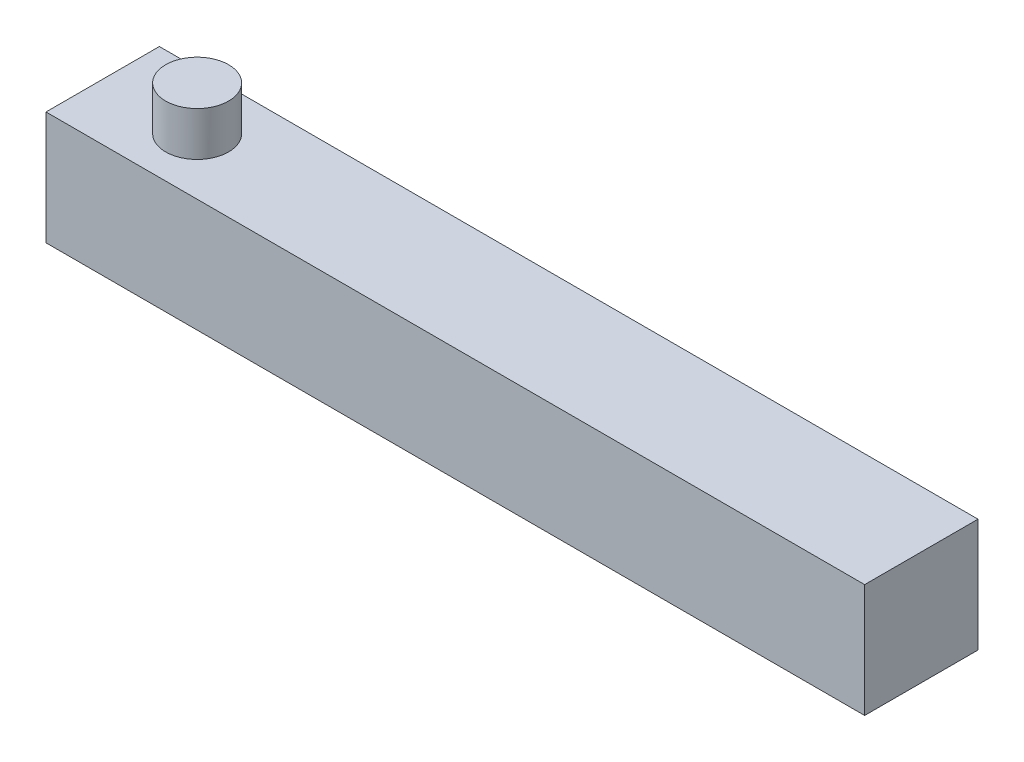
from build123d import *

# Parameters (mm, degrees)
SKETCH_1_W      = 65
SKETCH_1_H      = 9
EXTRUDE_1_DEPTH = 9
SKETCH_2_R      = 2.5
EXTRUDE_2_DEPTH = 3.5


with BuildPart() as part:
    # 草圖1 → 填料-伸長1 (new body)
    with BuildSketch(Plane(origin=(0, 0, 0), x_dir=(1, 0, 0), z_dir=(0, 1, 0))):
        Rectangle(SKETCH_1_W, SKETCH_1_H)
    extrude(amount=EXTRUDE_1_DEPTH)

    # 草圖2 → 填料-伸長2 (add)
    with BuildSketch(Plane(origin=(0, 9, 0), x_dir=(1, 0, 0), z_dir=(0, 1, 0))):
        with Locations(Location((-25, 0, 0), (0, 0, 90))):
            Circle(SKETCH_2_R)
    extrude(amount=EXTRUDE_2_DEPTH)


solid = part.part
